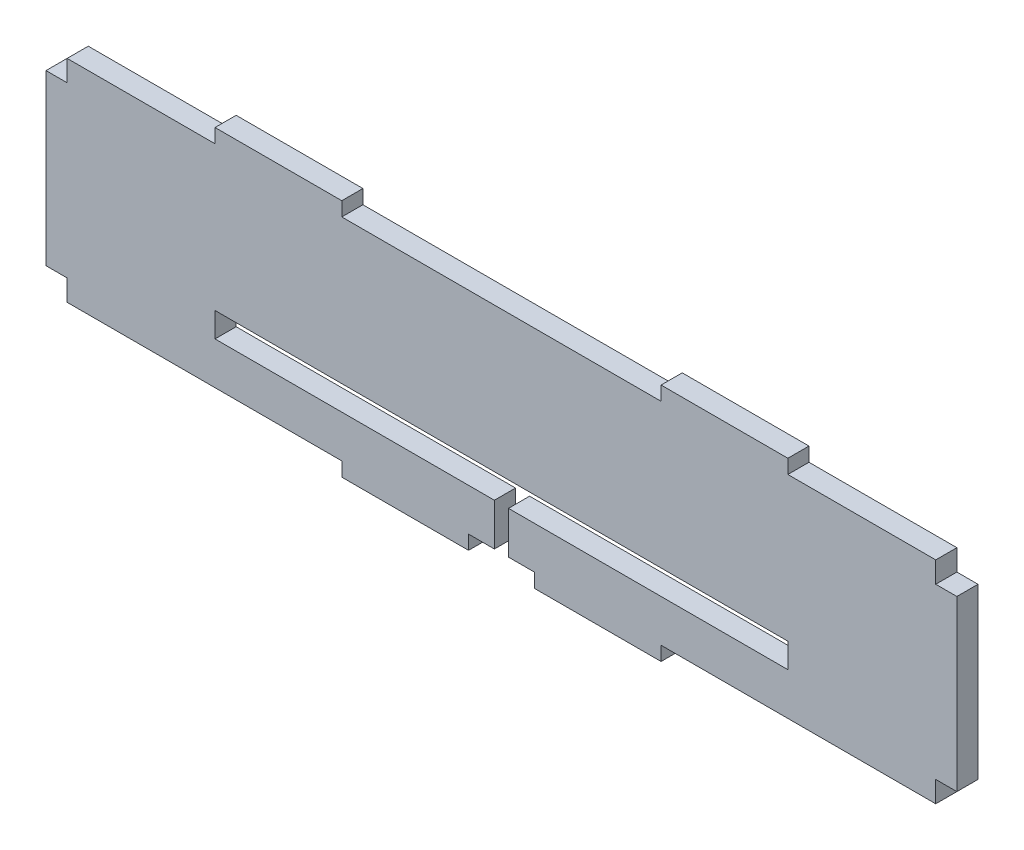
from build123d import *

# Parameters (mm, degrees)
BOSS_EXTRUDE3_DEPTH = 3


with BuildPart() as part:
    # Sketch1 → Boss-Extrude3 (new body)
    with BuildSketch(Plane.XY):
        Polygon((3, 3), (3, 0), (42, 0), (42, -2), (60, -2), (60, 0), (63.67, 0), (63.67, 6), (24, 6), (24, 9.5), (105.34, 9.5), (105.34, 6), (65.67, 6), (65.67, 0), (69.34, 0), (69.34, -2), (87.34, -2), (87.34, 0), (126.34, 0), (126.34, 3), (129.34, 3), (129.34, 27), (126.34, 27), (126.34, 30), (105.34, 30), (105.34, 32), (87.34, 32), (87.34, 30), (42, 30), (42, 32), (24, 32), (24, 30), (3, 30), (3, 27), (0, 27), (0, 3), align=None)
    extrude(amount=BOSS_EXTRUDE3_DEPTH)


solid = part.part
